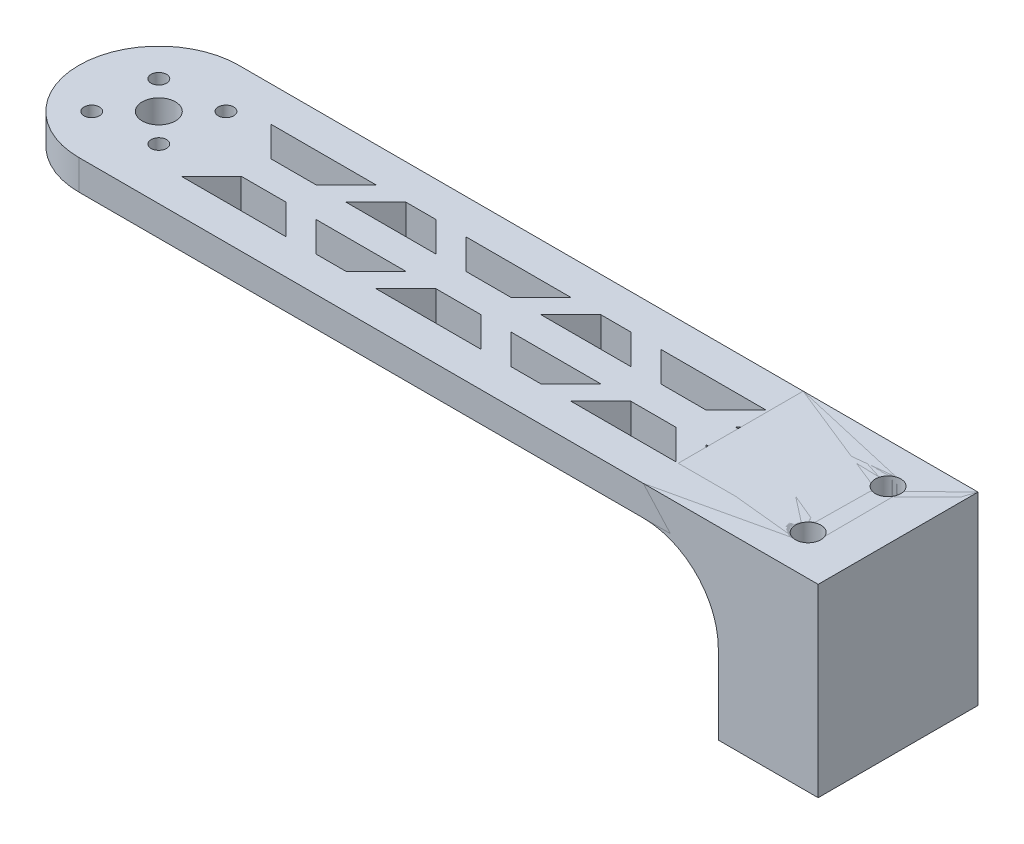
from build123d import *

# Parameters (mm, degrees)
BOSS_EXTRUDE1_DEPTH  = 6
CUT_EXTRUDE3_REACH   = 150.983
BOSS_EXTRUDE12_DEPTH = 16
SKETCH8_R            = 2.55
CUT_EXTRUDE4_DEPTH   = 154.391655575
SKETCH10_R           = 1.55
SKETCH10_R_2         = 3.325
CUT_EXTRUDE2_DEPTH   = 6


with BuildPart() as part:
    # Sketch1 → Boss-Extrude1 (new body)
    with BuildSketch(Plane(origin=(0, 0, 0), x_dir=(1, 0, 0), z_dir=(0, 1, 0))):
        with BuildLine():
            Line((0, -16), (148, -16))
            Line((148, -16), (148, 16))
            Line((148, 16), (0, 16))
            ThreePointArc((0, 16), (-16, 0), (0, -16))
        make_face()
    extrude(amount=-BOSS_EXTRUDE1_DEPTH)

    # Sketch11 → Cut-Extrude3 (cut, up to next)
    with BuildSketch(Plane(origin=(0, 0, 0), x_dir=(1, 0, 0), z_dir=(0, 1, 0)), mode=Mode.PRIVATE) as cut_extrude3_sk1:
        Polygon((13.5, 9), (19.5, 3), (28.5, 3), (34.5, 9), align=None)
    cut_extrude3_tool1 = extrude(cut_extrude3_sk1.sketch, amount=-CUT_EXTRUDE3_REACH, mode=Mode.PRIVATE) & part.part
    # Sketch11 → Cut-Extrude3 (cut, up to next)
    with BuildSketch(Plane(origin=(0, 0, 0), x_dir=(1, 0, 0), z_dir=(0, 1, 0)), mode=Mode.PRIVATE) as cut_extrude3_sk2:
        Polygon((52.5, 3), (46.5, 9), (40.5, 9), (34.5, 3), align=None)
    cut_extrude3_tool2 = extrude(cut_extrude3_sk2.sketch, amount=-CUT_EXTRUDE3_REACH, mode=Mode.PRIVATE) & part.part
    # Sketch11 → Cut-Extrude3 (cut, up to next)
    with BuildSketch(Plane(origin=(0, 0, 0), x_dir=(1, 0, 0), z_dir=(0, 1, 0)), mode=Mode.PRIVATE) as cut_extrude3_sk3:
        Polygon((52.5, 9), (58.5, 3), (67.5, 3), (73.5, 9), align=None)
    cut_extrude3_tool3 = extrude(cut_extrude3_sk3.sketch, amount=-CUT_EXTRUDE3_REACH, mode=Mode.PRIVATE) & part.part
    # Sketch11 → Cut-Extrude3 (cut, up to next)
    with BuildSketch(Plane(origin=(0, 0, 0), x_dir=(1, 0, 0), z_dir=(0, 1, 0)), mode=Mode.PRIVATE) as cut_extrude3_sk4:
        Polygon((91.5, 9), (97.5, 3), (106.5, 3), (112.5, 9), align=None)
    cut_extrude3_tool4 = extrude(cut_extrude3_sk4.sketch, amount=-CUT_EXTRUDE3_REACH, mode=Mode.PRIVATE) & part.part
    # Sketch11 → Cut-Extrude3 (cut, up to next)
    with BuildSketch(Plane(origin=(0, 0, 0), x_dir=(1, 0, 0), z_dir=(0, 1, 0)), mode=Mode.PRIVATE) as cut_extrude3_sk5:
        Polygon((73.5, 3), (91.5, 3), (85.5, 9), (79.5, 9), align=None)
    cut_extrude3_tool5 = extrude(cut_extrude3_sk5.sketch, amount=-CUT_EXTRUDE3_REACH, mode=Mode.PRIVATE) & part.part
    # Sketch11 → Cut-Extrude3 (cut, up to next)
    with BuildSketch(Plane(origin=(0, 0, 0), x_dir=(1, 0, 0), z_dir=(0, 1, 0)), mode=Mode.PRIVATE) as cut_extrude3_sk6:
        Polygon((112.5, 3), (130.5, 3), (124.5, 9), (118.5, 9), align=None)
    cut_extrude3_tool6 = extrude(cut_extrude3_sk6.sketch, amount=-CUT_EXTRUDE3_REACH, mode=Mode.PRIVATE) & part.part
    cut_extrude3_1 = cut_extrude3_tool1.solids().sort_by_distance((24, 0, -6.4))[0]
    add(cut_extrude3_1, mode=Mode.SUBTRACT)
    cut_extrude3_2 = cut_extrude3_tool2.solids().sort_by_distance((43.5, 0, -5.5))[0]
    add(cut_extrude3_2, mode=Mode.SUBTRACT)
    cut_extrude3_3 = cut_extrude3_tool3.solids().sort_by_distance((63, 0, -6.4))[0]
    add(cut_extrude3_3, mode=Mode.SUBTRACT)
    cut_extrude3_4 = cut_extrude3_tool4.solids().sort_by_distance((102, 0, -6.4))[0]
    add(cut_extrude3_4, mode=Mode.SUBTRACT)
    cut_extrude3_5 = cut_extrude3_tool5.solids().sort_by_distance((82.5, 0, -5.5))[0]
    add(cut_extrude3_5, mode=Mode.SUBTRACT)
    cut_extrude3_6 = cut_extrude3_tool6.solids().sort_by_distance((121.5, 0, -5.5))[0]
    add(cut_extrude3_6, mode=Mode.SUBTRACT)
    cut_extrude3 = cut_extrude3_1 + cut_extrude3_2 + cut_extrude3_3 + cut_extrude3_4 + cut_extrude3_5 + cut_extrude3_6  # Cut-Extrude3 as one shape, for the pattern or mirror that repeats it

    # Mirror1: Cut-Extrude3 across plane
    add(cut_extrude3.mirror(Plane.XY), mode=Mode.SUBTRACT)


with BuildPart() as body_2:
    # Sketch14 → Boss-Extrude12 (new, symmetric)
    with BuildSketch(Plane.XY):
        with BuildLine():
            Line((148, -6), (148, -37))
            Line((148, -37), (128, -37))
            Line((128, -37), (128, -21))
            ThreePointArc((128, -21), (123.606601718, -10.393398282), (113, -6))
            Line((113, -6), (113, 0))
            Line((113, 0), (148, 0))
            Line((148, 0), (148, -6))
        make_face()
    extrude(amount=BOSS_EXTRUDE12_DEPTH, both=True)


with BuildPart() as cut_extrude4_tool:
    # Sketch8 → Cut-Extrude4 (new, through all)
    with BuildSketch(Plane(origin=(0, 0, 0), x_dir=(1, 0, 0), z_dir=(0, 1, 0))):
        with Locations(Location((138, 8, 0), (0, 0, 270))):
            Circle(SKETCH8_R)
        with Locations(Location((138, -8, 0), (0, 0, 270))):
            Circle(SKETCH8_R)
    extrude(amount=-CUT_EXTRUDE4_DEPTH)


with BuildPart() as part_1:
    add(part.part)

    # Cut-Extrude4: cut by cut_extrude4_tool
    add(cut_extrude4_tool.part, mode=Mode.SUBTRACT)

    # Sketch10 → Cut-Extrude2 (cut)
    with BuildSketch(Plane(origin=(0, 0, 0), x_dir=(1, 0, 0), z_dir=(0, 1, 0))):
        with Locations(Location((-6.717514421, -6.717514421, 0), (0, 0, 270))):
            Circle(SKETCH10_R)
        with Locations(Location((6.717514421, 6.717514421, 0), (0, 0, 270))):
            Circle(SKETCH10_R)
        with Locations(Location((5.656854249, -5.656854249, 0), (0, 0, 270))):
            Circle(SKETCH10_R)
        with Locations(Location((-5.656854249, 5.656854249, 0), (0, 0, 270))):
            Circle(SKETCH10_R)
        with Locations(Location((0, 0, 0), (0, 0, 270))):
            Circle(SKETCH10_R_2)
    extrude(amount=-CUT_EXTRUDE2_DEPTH, mode=Mode.SUBTRACT)


with BuildPart() as body_2_1:
    add(body_2.part)

    # Cut-Extrude4: cut by cut_extrude4_tool
    add(cut_extrude4_tool.part, mode=Mode.SUBTRACT)


solid = Compound([part_1.part, body_2_1.part])
